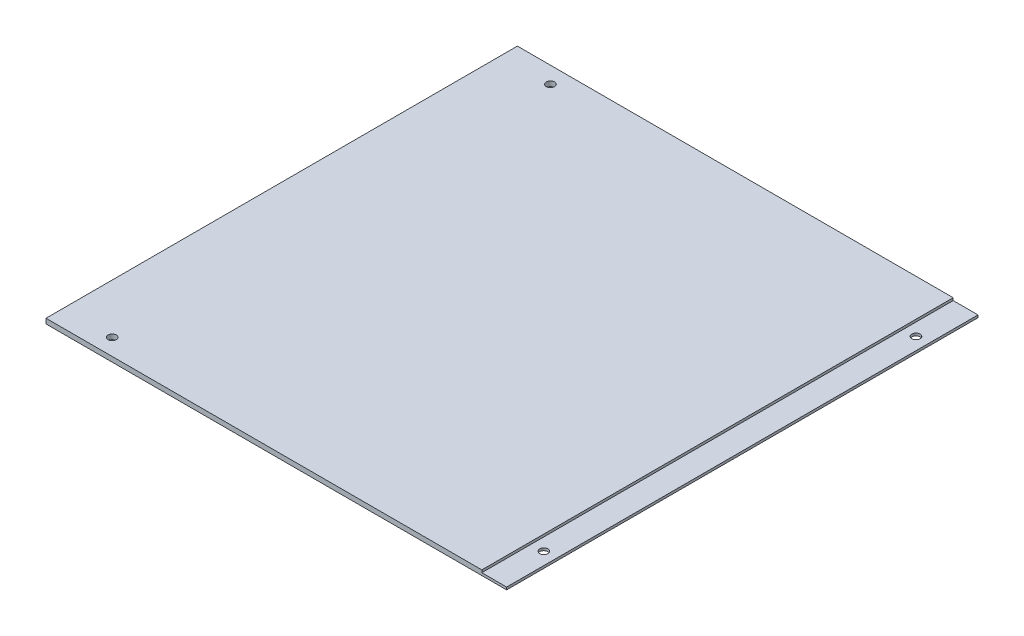
from build123d import *

# Parameters (mm, degrees)
SKETCH1_W           = 278.5
SKETCH1_H           = 285
BOSS_EXTRUDE1_DEPTH = 3
SKETCH2_W           = 15
SKETCH2_H           = 1.5
CUT_EXTRUDE1_DEPTH  = 318.213748914
CUT_EXTRUDE3_REACH  = 201.263
SKETCH4_R           = 2.5
CUT_EXTRUDE4_REACH  = 201.263
SKETCH5_R           = 2.5


with BuildPart() as part:
    # Sketch1 → Boss-Extrude1 (new body)
    with BuildSketch(Plane(origin=(0, 0, 0), x_dir=(1, 0, 0), z_dir=(0, 1, 0))):
        Rectangle(SKETCH1_W, SKETCH1_H)
    extrude(amount=BOSS_EXTRUDE1_DEPTH)

    # Sketch2 → Cut-Extrude1 (cut, through all)
    with BuildSketch(Plane.XY.offset(142.5)):
        with Locations((131.75, 2.25)):
            Rectangle(SKETCH2_W, SKETCH2_H)
    extrude(amount=-CUT_EXTRUDE1_DEPTH, mode=Mode.SUBTRACT)

    # Sketch4 → Cut-Extrude3 (cut, up to next)
    with BuildSketch(Plane.XZ, mode=Mode.PRIVATE) as cut_extrude3_sk1:
        with Locations(Location((-109.25, -132.5, 0), (0, 0, 270))):
            Circle(SKETCH4_R)
    cut_extrude3_tool1 = extrude(cut_extrude3_sk1.sketch, amount=-CUT_EXTRUDE3_REACH, mode=Mode.PRIVATE) & part.part
    # Sketch4 → Cut-Extrude3 (cut, up to next)
    with BuildSketch(Plane.XZ, mode=Mode.PRIVATE) as cut_extrude3_sk2:
        with Locations(Location((-109.25, 132.5, 0), (0, 0, 270))):
            Circle(SKETCH4_R)
    cut_extrude3_tool2 = extrude(cut_extrude3_sk2.sketch, amount=-CUT_EXTRUDE3_REACH, mode=Mode.PRIVATE) & part.part
    add(cut_extrude3_tool1.solids().sort_by_distance((-109.25, 0, -132.5))[0], mode=Mode.SUBTRACT)
    add(cut_extrude3_tool2.solids().sort_by_distance((-109.25, 0, 132.5))[0], mode=Mode.SUBTRACT)

    # Sketch5 → Cut-Extrude4 (cut, up to next)
    with BuildSketch(Plane.XZ, mode=Mode.PRIVATE) as cut_extrude4_sk1:
        with Locations(Location((131.75, -112.5, 0), (0, 0, 270))):
            Circle(SKETCH5_R)
    cut_extrude4_tool1 = extrude(cut_extrude4_sk1.sketch, amount=-CUT_EXTRUDE4_REACH, mode=Mode.PRIVATE) & part.part
    # Sketch5 → Cut-Extrude4 (cut, up to next)
    with BuildSketch(Plane.XZ, mode=Mode.PRIVATE) as cut_extrude4_sk2:
        with Locations(Location((131.75, 112.5, 0), (0, 0, 270))):
            Circle(SKETCH5_R)
    cut_extrude4_tool2 = extrude(cut_extrude4_sk2.sketch, amount=-CUT_EXTRUDE4_REACH, mode=Mode.PRIVATE) & part.part
    add(cut_extrude4_tool1.solids().sort_by_distance((131.75, 0, -112.5))[0], mode=Mode.SUBTRACT)
    add(cut_extrude4_tool2.solids().sort_by_distance((131.75, 0, 112.5))[0], mode=Mode.SUBTRACT)


solid = part.part
